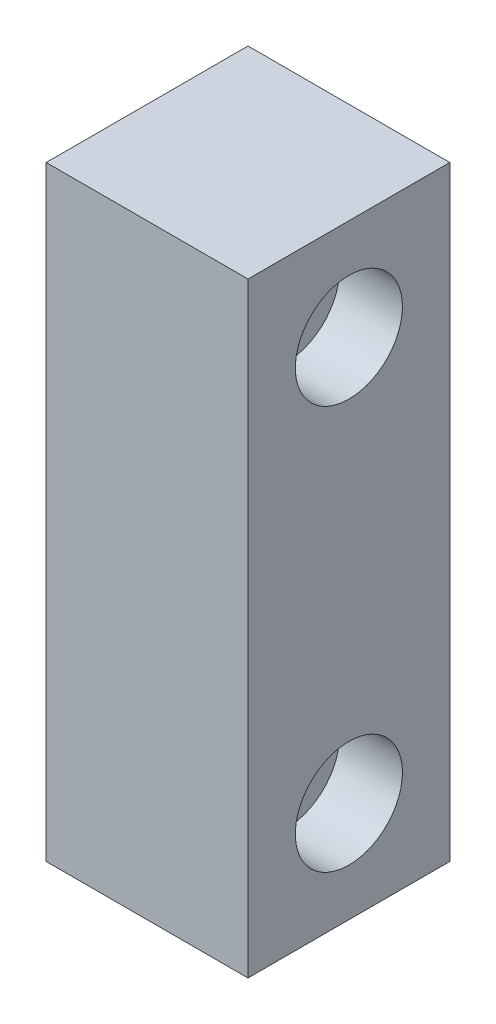
from build123d import *

# Parameters (mm, degrees)
SKETCH1_W           = 76.2
SKETCH1_H           = 25.4
BOSS_EXTRUDE1_DEPTH = 25.4
CUT_EXTRUDE2_START  = 25.4
SKETCH2_R           = 4.3688
CUT_EXTRUDE2_DEPTH  = 76.2
CUT_EXTRUDE4_START  = 25.4
SKETCH3_R           = 6.7437
CUT_EXTRUDE4_DEPTH  = 7.9248
CUT_EXTRUDE6_START  = 25.4
SKETCH4_R           = 4.3688
CUT_EXTRUDE6_DEPTH  = 76.2
CUT_EXTRUDE8_START  = 25.4
SKETCH5_R           = 6.7437
CUT_EXTRUDE8_DEPTH  = 7.9248


with BuildPart() as part:
    # Sketch1 → Boss-Extrude1 (new body)
    with BuildSketch(Plane.YZ):
        with Locations((38.1, 12.7)):
            Rectangle(SKETCH1_W, SKETCH1_H)
    extrude(amount=BOSS_EXTRUDE1_DEPTH)

    # Sketch2 → Cut-Extrude2 (cut)
    with BuildSketch(Plane.YZ.offset(CUT_EXTRUDE2_START)):
        with Locations(Location((12.7, 12.7, 0), (0, 0, 270))):
            Circle(SKETCH2_R)
    extrude(amount=-CUT_EXTRUDE2_DEPTH, mode=Mode.SUBTRACT)

    # Sketch3 → Cut-Extrude4 (cut)
    with BuildSketch(Plane.YZ.offset(CUT_EXTRUDE4_START)):
        with Locations(Location((12.7, 12.7, 0), (0, 0, 270))):
            Circle(SKETCH3_R)
    extrude(amount=-CUT_EXTRUDE4_DEPTH, mode=Mode.SUBTRACT)

    # Sketch4 → Cut-Extrude6 (cut)
    with BuildSketch(Plane.YZ.offset(CUT_EXTRUDE6_START)):
        with Locations(Location((63.5, 12.7, 0), (0, 0, 270))):
            Circle(SKETCH4_R)
    extrude(amount=-CUT_EXTRUDE6_DEPTH, mode=Mode.SUBTRACT)

    # Sketch5 → Cut-Extrude8 (cut)
    with BuildSketch(Plane.YZ.offset(CUT_EXTRUDE8_START)):
        with Locations(Location((63.5, 12.7, 0), (0, 0, 270))):
            Circle(SKETCH5_R)
    extrude(amount=-CUT_EXTRUDE8_DEPTH, mode=Mode.SUBTRACT)


solid = part.part
